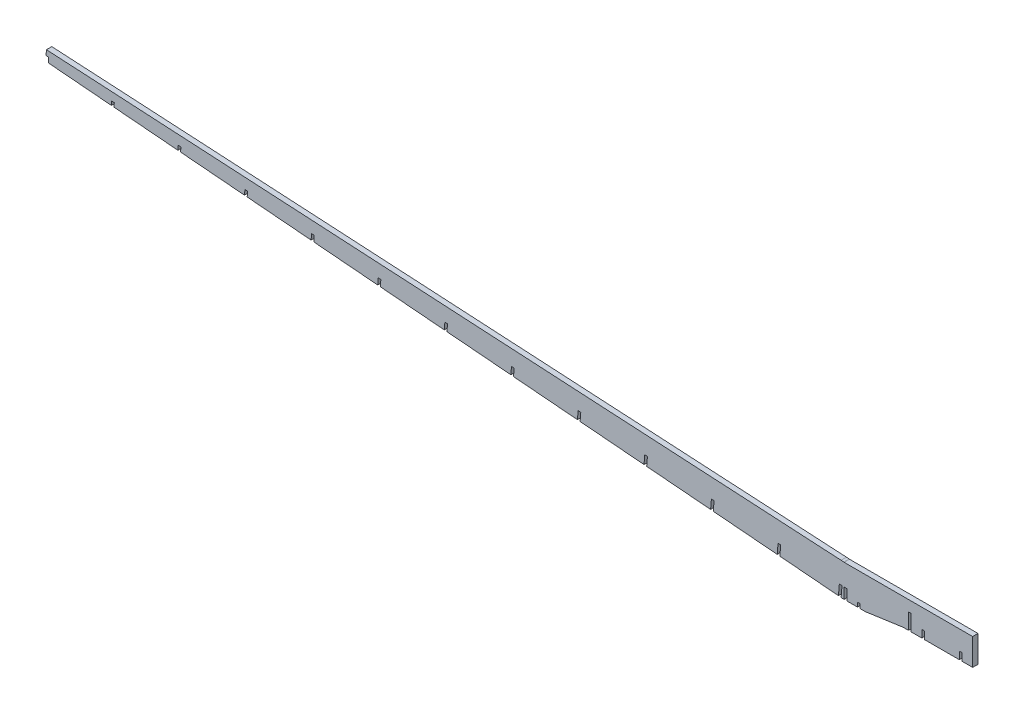
from build123d import *

# Parameters (mm, degrees)
BOSS_EXTRUDE1_DEPTH = 3.175
CUT_EXTRUDE1_DEPTH  = 955.556499367


with BuildPart() as part:
    # Sketch1 → Boss-Extrude1 (new, symmetric)
    with BuildSketch(Plane.XY):
        Polygon((76.2, 37.697541537), (76.2, 56.747541537), (79.375, 56.747541537), (79.375, 37.697541537), (92.075, 37.697541537), (92.075, 46.587541537), (95.25, 46.587541537), (95.25, 37.697541537), (136.525, 37.697541537), (136.525, 46.587541537), (139.7, 46.587541537), (139.7, 37.697541537), (152.4, 37.697541537), (152.4, 69.447541537), (0, 69.447541537), (-0.423998633, 69.491926731), (-3.587863461, 69.757603883), (-946.051908629, 122.953392794), (-946.583462345, 116.623288424), (-943.412318182, 116.444298555), (-943.91275138, 110.48479854), (-6.775989292, 31.791225946), (-5.713280681, 44.446685258), (-2.549415853, 44.181008106), (-3.612124464, 31.525548794), (-1.492292584, 31.347541537), (0, 31.347541537), (0, 44.047541537), (3.175, 44.047541537), (3.175, 31.347541537), (15.875, 31.347541537), (15.875, 36.427541537), (19.05, 36.427541537), (19.05, 31.347541537), (25.4, 31.347541537), (69.85, 37.697541537), align=None)
    extrude(amount=BOSS_EXTRUDE1_DEPTH, both=True)

    # Sketch2 → Cut-Extrude1 (cut, through all)
    with BuildSketch(Plane.XY.offset(3.175)):
        Polygon((-76.254460917, 37.625496217), (-75.245037036, 49.646404609), (-78.411328309, 49.883186), (-79.418325745, 37.891173369), align=None)
        Polygon((-155.224527027, 44.256797945), (-154.27566721, 55.556468134), (-157.441958483, 55.793249525), (-158.388391855, 44.522475098), align=None)
        Polygon((-234.194593137, 50.888099674), (-233.306297384, 61.466531659), (-236.472588657, 61.70331305), (-237.358457965, 51.153776826), align=None)
        Polygon((-313.164659247, 57.519401402), (-312.336927558, 67.376595183), (-315.503218831, 67.613376574), (-316.328524075, 57.785078555), align=None)
        Polygon((-392.134725356, 64.15070313), (-391.367557732, 73.286658708), (-394.533849005, 73.523440099), (-395.298590185, 64.416380283), align=None)
        Polygon((-471.104791466, 70.782004859), (-470.398187906, 79.196722233), (-473.564479179, 79.433503624), (-474.268656294, 71.047682011), align=None)
        Polygon((-550.074857576, 77.413306587), (-549.42881808, 85.106785757), (-552.595109353, 85.343567149), (-553.238722404, 77.67898374), align=None)
        Polygon((-629.044923686, 84.044608316), (-628.459448254, 91.016849282), (-631.625739527, 91.253630673), (-632.208788514, 84.310285468), align=None)
        Polygon((-708.014989796, 90.675910044), (-707.490078428, 96.926912807), (-710.656369701, 97.163694198), (-711.178854624, 90.941587197), align=None)
        Polygon((-786.985055905, 97.307211772), (-786.520708602, 102.836976331), (-789.686999875, 103.073757723), (-790.148920734, 97.572888925), align=None)
        Polygon((-865.955122015, 103.938513501), (-865.551338776, 108.747039856), (-868.717630049, 108.983821247), (-869.118986843, 104.204190653), align=None)
    extrude(amount=-CUT_EXTRUDE1_DEPTH, mode=Mode.SUBTRACT)


solid = part.part
